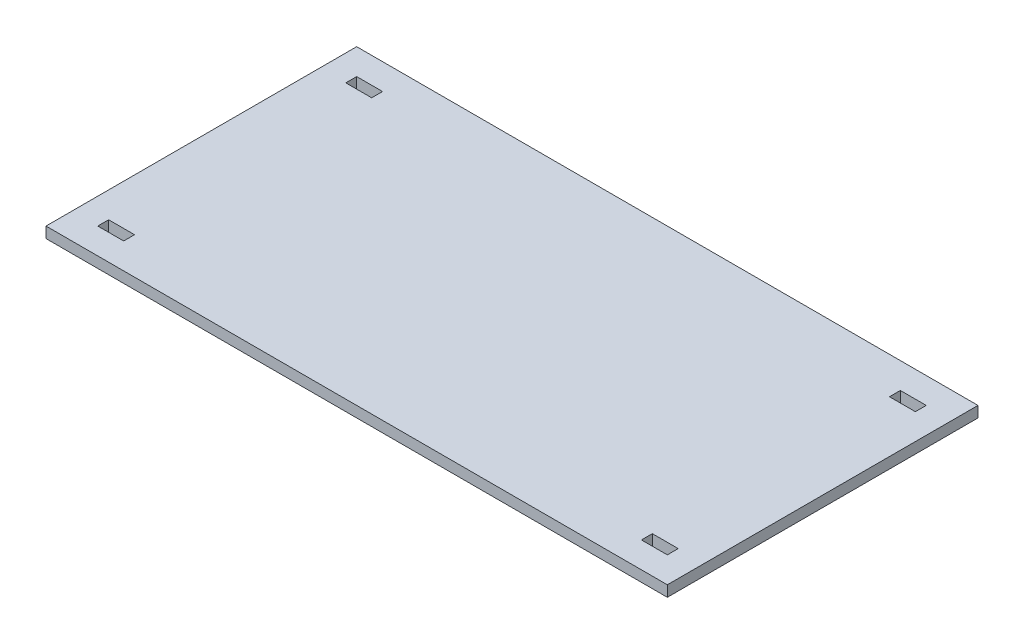
from build123d import *

# Parameters (mm, degrees)
SKETCH1_W           = 304.8
SKETCH1_H           = 152.4
BOSS_EXTRUDE1_DEPTH = 5.334
SKETCH4_W           = 12.7
SKETCH4_H           = 5.334
CUT_EXTRUDE1_DEPTH  = 252.586384458


with BuildPart() as part:
    # Sketch1 → Boss-Extrude1 (new body)
    with BuildSketch(Plane(origin=(0, 0, 0), x_dir=(1, 0, 0), z_dir=(0, 1, 0))):
        with Locations((-63.754910023, -52.424694992)):
            Rectangle(SKETCH1_W, SKETCH1_H)
    extrude(amount=BOSS_EXTRUDE1_DEPTH)

    # Sketch4 → Cut-Extrude1 (cut, through all)
    with BuildSketch(Plane(origin=(0, 5.334, 0), x_dir=(1, 0, 0), z_dir=(0, 1, 0))):
        with Locations((69.595089977, -113.257694992)):
            Rectangle(SKETCH4_W, SKETCH4_H)
        with Locations((-197.104910023, -113.257694992)):
            Rectangle(SKETCH4_W, SKETCH4_H)
        with Locations((69.595089977, 8.408305008)):
            Rectangle(SKETCH4_W, SKETCH4_H)
        with Locations((-197.104910023, 8.408305008)):
            Rectangle(SKETCH4_W, SKETCH4_H)
    extrude(amount=-CUT_EXTRUDE1_DEPTH, mode=Mode.SUBTRACT)


solid = part.part
